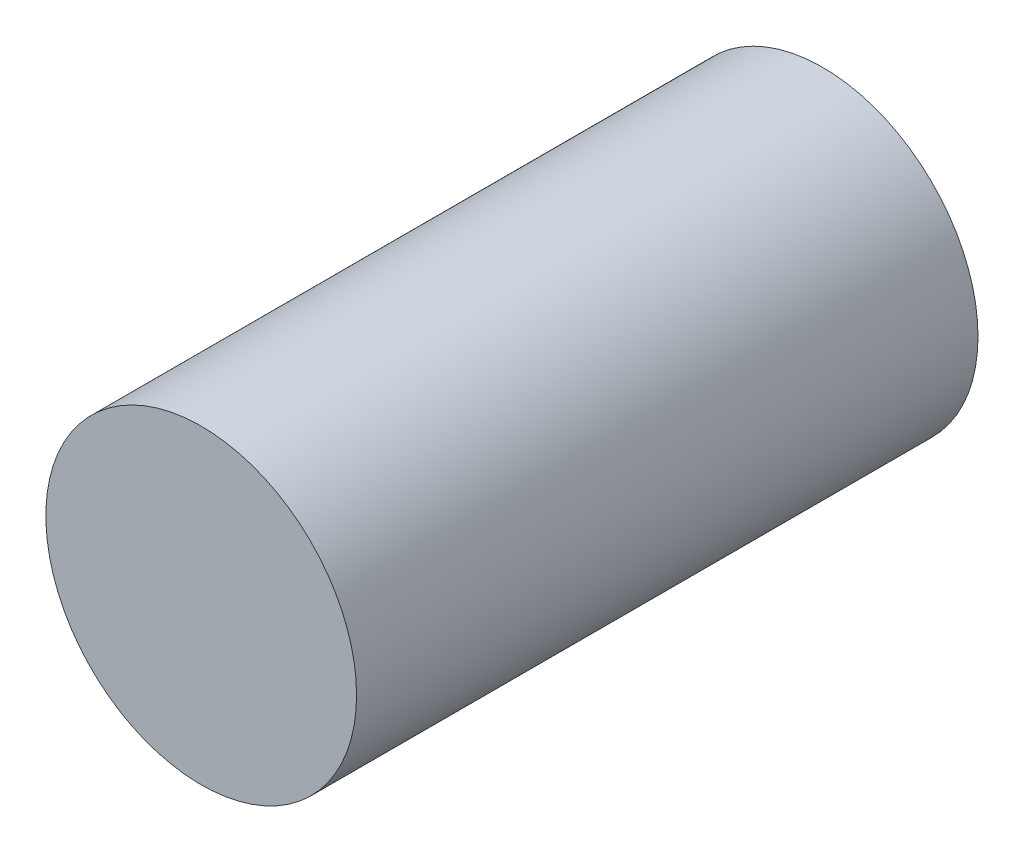
from build123d import *

# Parameters (mm, degrees)
ESBO_O1_R                = 20
RESSALTO_EXTRUS_O2_DEPTH = 80


with BuildPart() as part:
    # Esboço1 → Ressalto-extrusão2 (new body)
    with BuildSketch(Plane.XY):
        Circle(ESBO_O1_R)
    extrude(amount=RESSALTO_EXTRUS_O2_DEPTH)


solid = part.part
